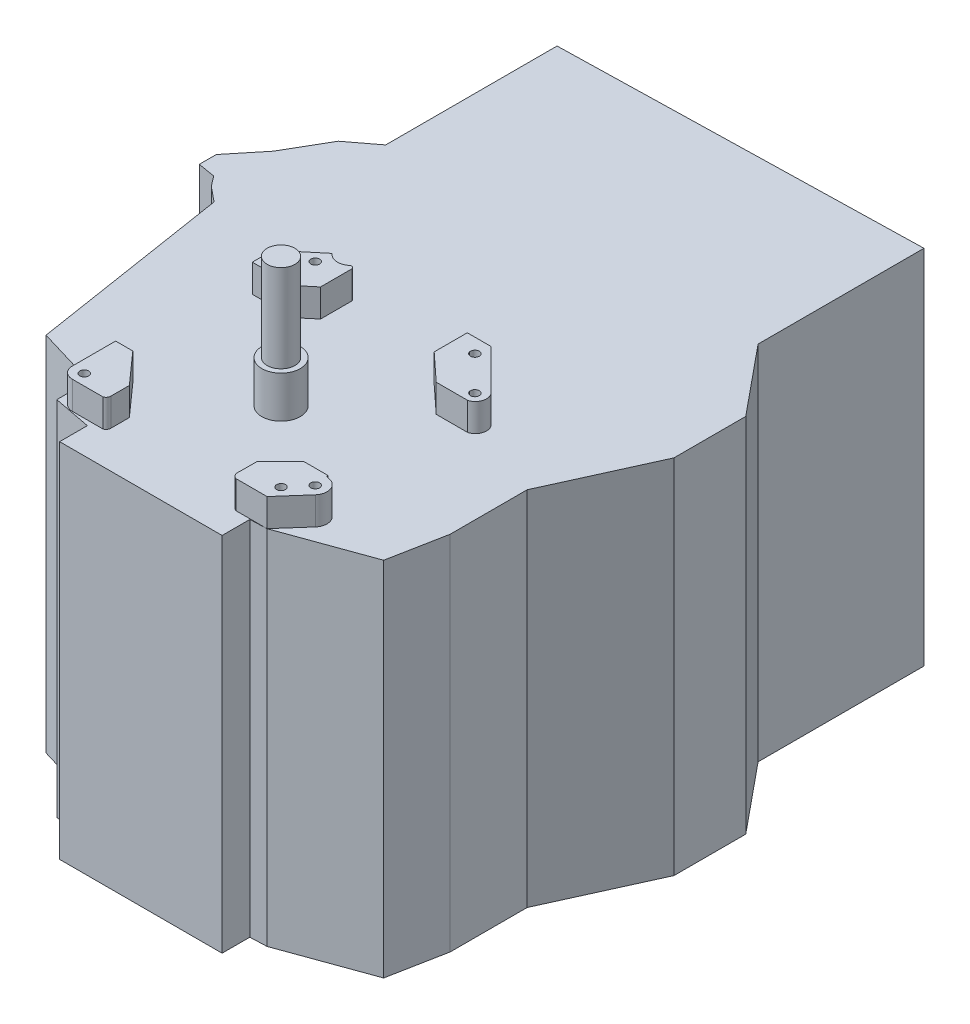
from build123d import *

# Parameters (mm, degrees)
BOSS_EXTRUDE1_DEPTH   = 25.4
BOSS_EXTRUDE1_2_DEPTH = 25.4
BOSS_EXTRUDE1_3_DEPTH = 25.4
BOSS_EXTRUDE1_4_DEPTH = 25.4
SKETCH2_W             = 480.06
SKETCH2_H             = 558.8
BOSS_EXTRUDE2_DEPTH   = 330.2
SKETCH3_R             = 4
CUT_EXTRUDE1_DEPTH    = 25.4
SKETCH4_OUTSIDE_W     = 645.666
SKETCH4_OUTSIDE_H     = 724.406
CUT_EXTRUDE2_DEPTH    = 593.37706615


with BuildPart() as part:
    # Sketch1 → Boss-Extrude1 (new body)
    with BuildSketch(Plane(origin=(0, 0, 0), x_dir=(1, 0, 0), z_dir=(0, 1, 0))):
        with BuildLine():
            Line((-96.837092986, 97.150255072), (-71.640714597, 118.188007902))
            ThreePointArc((-71.640714597, 118.188007902), (-63.230981722, 113.784072736), (-54.170350157, 116.61659946))
            ThreePointArc((-54.170350157, 116.61659946), (-51.714278497, 116.93537746), (-50.384837267, 114.845761843))
            Line((-50.384837267, 114.845761843), (-50.384837267, 86.386753625))
            Line((-50.384837267, 86.386753625), (-64.20518989, 74.847430075))
            Line((-64.20518989, 74.847430075), (-101.118031062, 74.847430075))
            Line((-101.118031062, 74.847430075), (-101.118031062, 86.386753625))
            ThreePointArc((-101.118031062, 86.386753625), (-100.008521641, 92.178545105), (-96.837092986, 97.150255072))
        make_face()
    extrude(amount=BOSS_EXTRUDE1_DEPTH)



with BuildPart() as body_2:
    # Sketch1 → Boss-Extrude1 2 (new body)
    with BuildSketch(Plane(origin=(0, 0, 0), x_dir=(1, 0, 0), z_dir=(0, 1, 0))):
        with BuildLine():
            Line((74.668954211, 117.152711286), (110.821720745, 80.999944752))
            ThreePointArc((110.821720745, 80.999944752), (113.511096586, 71.213573372), (106.47339755, 63.900803754))
            Line((106.47339755, 63.900803754), (77.67946477, 63.900803754))
            Line((77.67946477, 63.900803754), (52.817233656, 86.912822321))
            Line((52.817233656, 86.912822321), (52.817233656, 117.152711286))
            Line((52.817233656, 117.152711286), (74.668954211, 117.152711286))
        make_face()
    extrude(amount=BOSS_EXTRUDE1_2_DEPTH)


with BuildPart() as body_3:
    # Sketch1 → Boss-Extrude1 3 (new body)
    with BuildSketch(Plane(origin=(0, 0, 0), x_dir=(1, 0, 0), z_dir=(0, 1, 0))):
        with BuildLine():
            Line((101.935500603, -59.213572652), (79.8914645, -59.213572652))
            Line((79.8914645, -59.213572652), (58.666215674, -80.12896383))
            Line((58.666215674, -80.12896383), (58.532888269, -98.261490932))
            ThreePointArc((58.532888269, -98.261490932), (59.632317978, -101.638366389), (62.539436263, -103.678145009))
            Line((62.539436263, -103.678145009), (90.891410972, -103.678145009))
            Line((90.891410972, -103.678145009), (111.599895162, -80.218183899))
            ThreePointArc((111.599895162, -80.218183899), (113.624042847, -68.197309046), (103.737554202, -61.06597338))
            ThreePointArc((103.737554202, -61.06597338), (102.482264089, -60.484407667), (101.935500603, -59.213572652))
        make_face()
    extrude(amount=BOSS_EXTRUDE1_3_DEPTH)


with BuildPart() as body_4:
    # Sketch1 → Boss-Extrude1 4 (new body)
    with BuildSketch(Plane(origin=(0, 0, 0), x_dir=(1, 0, 0), z_dir=(0, 1, 0))):
        with BuildLine():
            Line((-101.118031062, -49.88273865), (-85.446303061, -49.88273865))
            Line((-85.446303061, -49.88273865), (-59.759299832, -78.701891229))
            Line((-59.759299832, -78.701891229), (-59.759299832, -95.602011568))
            ThreePointArc((-59.759299832, -95.602011568), (-60.552850284, -98.145288547), (-62.651891139, -99.786022408))
            Line((-62.651891139, -99.786022408), (-90.751548629, -99.786022408))
            ThreePointArc((-90.751548629, -99.786022408), (-97.698167691, -97.137410822), (-101.118031062, -90.536259843))
            Line((-101.118031062, -90.536259843), (-101.118031062, -49.88273865))
        make_face()
    extrude(amount=BOSS_EXTRUDE1_4_DEPTH)


with BuildPart() as part_1:
    add(part.part)

    add(body_2.part)  # Boss-Extrude2 merges body 2

    add(body_3.part)  # Boss-Extrude2 merges body 3

    add(body_4.part)  # Boss-Extrude2 merges body 4
    # Sketch2 → Boss-Extrude2 (add)
    with BuildSketch(Plane.XZ):
        with Locations((0, -149.86)):
            Rectangle(SKETCH2_W, SKETCH2_H)
    extrude(amount=BOSS_EXTRUDE2_DEPTH)

    # Sketch3 → Cut-Extrude1 (cut)
    with BuildSketch(Plane(origin=(0, 25.4, 0), x_dir=(1, 0, 0), z_dir=(0, 1, 0))):
        with Locations(Location((-72.844207417, 104.032309625, 0), (0, 0, 270))):
            Circle(SKETCH3_R)
        with Locations(Location((-89.802561211, 89.802561211, 0), (0, 0, 270))):
            Circle(SKETCH3_R)
        with Locations(Location((72.844207417, 104.032309625, 0), (0, 0, 270))):
            Circle(SKETCH3_R)
        with Locations(Location((104.032309625, 72.844207417, 0), (0, 0, 270))):
            Circle(SKETCH3_R)
        with Locations(Location((104.032309625, -72.844207417, 0), (0, 0, 270))):
            Circle(SKETCH3_R)
        with Locations(Location((89.802561211, -89.802561211, 0), (0, 0, 270))):
            Circle(SKETCH3_R)
        with Locations(Location((-89.802561211, -89.802561211, 0), (0, 0, 270))):
            Circle(SKETCH3_R)
    extrude(amount=-CUT_EXTRUDE1_DEPTH, mode=Mode.SUBTRACT)

    # Sketch4 outside → Cut-Extrude2 (cut, through all)
    with BuildSketch(Plane(origin=(0, 0, 0), x_dir=(1, 0, 0), z_dir=(0, 1, 0))):
        with Locations((0, 149.86)):
            Rectangle(SKETCH4_OUTSIDE_W, SKETCH4_OUTSIDE_H)
        Polygon((-158.279335317, 410.160127995), (-158.279335317, 253.757688154), (-182.885606621, 235.091664712), (-204.629450169, 197.534116765), (-228.020554592, 168.871777543), (-228.020554592, 153.387525319), (-212.206850193, 150.751907919), (-205.243518845, 141.572576238), (-191.544400642, 130.392836095), (-162.928834853, -51.578012232), (-107.061270396, -68.314598595), (-107.061270396, -97.612864929), (-72.544742183, -104.241356388), (-72.544742183, -129.54), (75.724330275, -129.54), (75.724330275, -104.241356388), (90.891410972, -103.678145009), (169.036183047, -75.400018607), (178.818243754, -24.461916559), (178.818243754, 45.804512317), (220.576619594, 137.985435591), (220.576619594, 203.52309478), (169.036183047, 266.313437523), (169.036183047, 417.717672305), align=None, mode=Mode.SUBTRACT)
    extrude(amount=-CUT_EXTRUDE2_DEPTH, mode=Mode.SUBTRACT)

    # Sketch5 → Revolve-Thin1 (revolve)
    with BuildSketch(Plane(origin=(0, 0, 0), x_dir=(0, 0, -1), z_dir=(1, 0, 0))):
        Polygon((-17.5, 0), (-17.5, 38), (-12.695, 38), (-12.695, 118), (0, 118), (0, 0), (-2.54, 0), (-2.54, 115.46), (-10.155, 115.46), (-10.155, 35.46), (-14.96, 35.46), (-14.96, 0), align=None)
    revolve(axis=Axis((0, 118, 0), (0, -1, 0)))


solid = part_1.part
